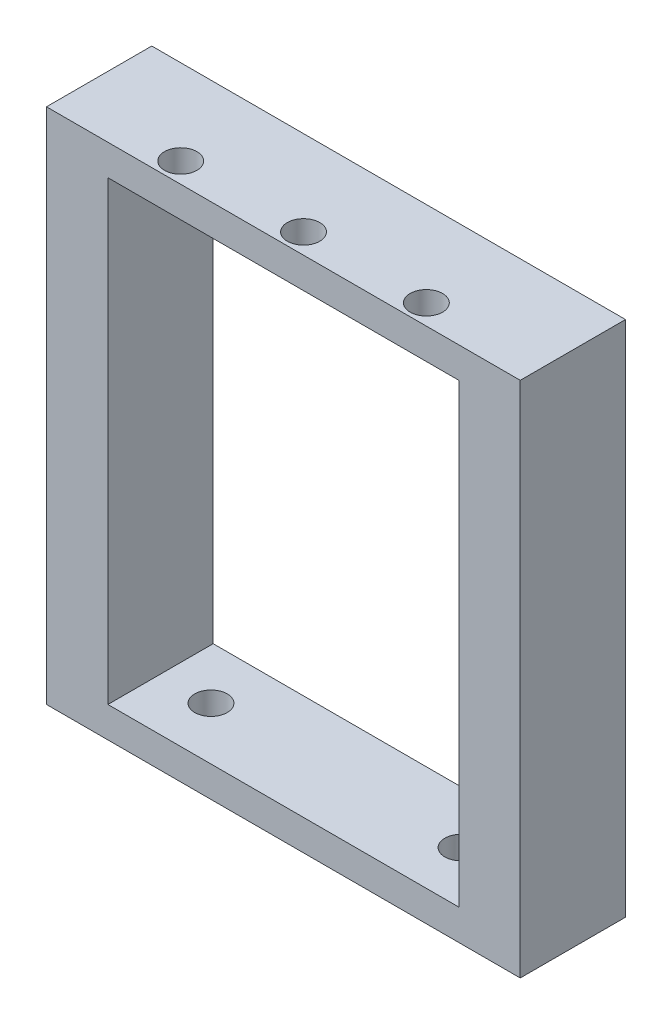
from build123d import *

# Parameters (mm, degrees)
SKETCH1_W           = 54
SKETCH1_H           = 59
SKETCH1_W_2         = 40
SKETCH1_H_2         = 52
BOSS_EXTRUDE1_DEPTH = 12
SKETCH2_R           = 1.85
CUT_EXTRUDE1_DEPTH  = 10
SKETCH3_R           = 1.85
CUT_EXTRUDE2_DEPTH  = 10


with BuildPart() as part:
    # Sketch1 → Boss-Extrude1 (new body)
    with BuildSketch(Plane.XY):
        with Locations((27, 29.5)):
            Rectangle(SKETCH1_W, SKETCH1_H)
        with Locations((27, 29.5)):
            Rectangle(SKETCH1_W_2, SKETCH1_H_2, mode=Mode.SUBTRACT)
    extrude(amount=BOSS_EXTRUDE1_DEPTH)

    # Sketch2 → Cut-Extrude1 (cut)
    with BuildSketch(Plane(origin=(0, 59, 0), x_dir=(1, 0, 0), z_dir=(0, 1, 0))):
        with Locations(Location((13, -9.7, 0), (0, 0, 180))):
            Circle(SKETCH2_R)
        with Locations(Location((41, -9.7, 0), (0, 0, 180))):
            Circle(SKETCH2_R)
        with Locations(Location((27, -9.7, 0), (0, 0, 180))):
            Circle(SKETCH2_R)
    extrude(amount=-CUT_EXTRUDE1_DEPTH, mode=Mode.SUBTRACT)

    # Sketch3 → Cut-Extrude2 (cut)
    with BuildSketch(Plane.XZ):
        with Locations(Location((12.75, 6, 0), (0, 0, 270))):
            Circle(SKETCH3_R)
        with Locations(Location((41.25, 6, 0), (0, 0, 90))):
            Circle(SKETCH3_R)
    extrude(amount=-CUT_EXTRUDE2_DEPTH, mode=Mode.SUBTRACT)


solid = part.part
